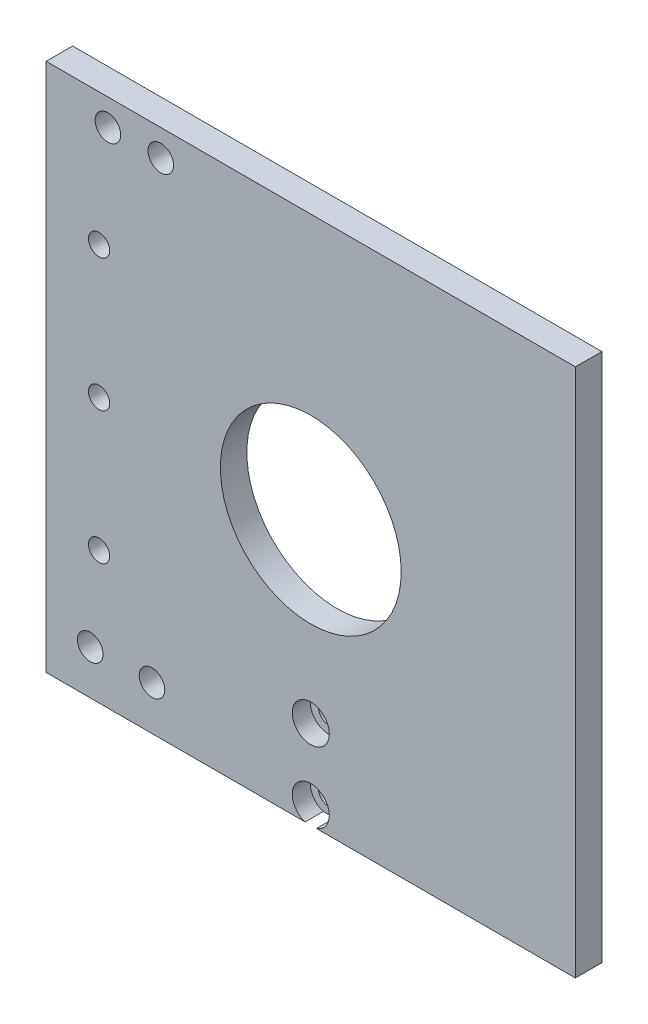
from build123d import *

# Parameters (mm, degrees)
SKETCH1_W                              = 60
SKETCH1_H                              = 60
BOSS_EXTRUDE1_DEPTH                    = 3
SKETCH2_R                              = 10.25
CUT_EXTRUDE1_DEPTH                     = 43.532340636
SKETCH3_R                              = 1.45
SERVO_Y_MOUNT_D2P9_DEPTH               = 3.01
SKETCH4_R                              = 1.45
CUT_EXTRUDE5_DEPTH                     = 43.532340636
SKETCH5_R                              = 1.2
GUIDERAIL1_D2P4_DEPTH                  = 3.01
SKETCH6_R                              = 1.2
GUIDEBLOCK2_D2P4_DEPTH                 = 3.01
SKETCH7_R                              = 2.1
GUIDEBLOCK2_HEADCOUNTERBORE_D4P2_DEPTH = 2.05


with BuildPart() as part:
    # Sketch1 → Boss-Extrude1 (new body)
    with BuildSketch(Plane.XY):
        Rectangle(SKETCH1_W, SKETCH1_H)
    extrude(amount=BOSS_EXTRUDE1_DEPTH)

    # Sketch2 → Cut-Extrude1 (cut, through all)
    with BuildSketch(Plane.XY.offset(3)):
        Circle(SKETCH2_R)
    extrude(amount=-CUT_EXTRUDE1_DEPTH, mode=Mode.SUBTRACT)

    # Sketch3 → Servo_Y_Mount_D2p9 (cut)
    with BuildSketch(Plane(origin=(0, 0, 0), x_dir=(-1, 0, 0), z_dir=(0, 0, -1))):
        with Locations((18, -25)):
            Circle(SKETCH3_R)
        with Locations((25, -25)):
            Circle(SKETCH3_R)
    extrude(amount=-SERVO_Y_MOUNT_D2P9_DEPTH, mode=Mode.SUBTRACT)

    # Sketch4 → Cut-Extrude5 (cut, through all)
    with BuildSketch(Plane(origin=(0, 0, 0), x_dir=(-1, 0, 0), z_dir=(0, 0, -1))):
        with Locations((17, 27)):
            Circle(SKETCH4_R)
        with Locations((23, 27)):
            Circle(SKETCH4_R)
    extrude(amount=-CUT_EXTRUDE5_DEPTH, mode=Mode.SUBTRACT)

    # Sketch5 → GuideRail1_D2p4 (cut)
    with BuildSketch(Plane.XY.offset(3)):
        with Locations((-24, -15)):
            Circle(SKETCH5_R)
        with Locations((-24, 0)):
            Circle(SKETCH5_R)
        with Locations((-24, 15)):
            Circle(SKETCH5_R)
    extrude(amount=-GUIDERAIL1_D2P4_DEPTH, mode=Mode.SUBTRACT)

    # Sketch6 → GuideBlock2_D2p4 (cut)
    with BuildSketch(Plane.XY.offset(3)):
        with Locations((0, -28)):
            Circle(SKETCH6_R)
        with Locations((0, -20)):
            Circle(SKETCH6_R)
    extrude(amount=-GUIDEBLOCK2_D2P4_DEPTH, mode=Mode.SUBTRACT)

    # Sketch7 → GuideBlock2_HeadCounterbore_D4p2 (cut)
    with BuildSketch(Plane.XY.offset(3)):
        with Locations((0, -28)):
            Circle(SKETCH7_R)
        with Locations((0, -20)):
            Circle(SKETCH7_R)
    extrude(amount=-GUIDEBLOCK2_HEADCOUNTERBORE_D4P2_DEPTH, mode=Mode.SUBTRACT)


solid = part.part
